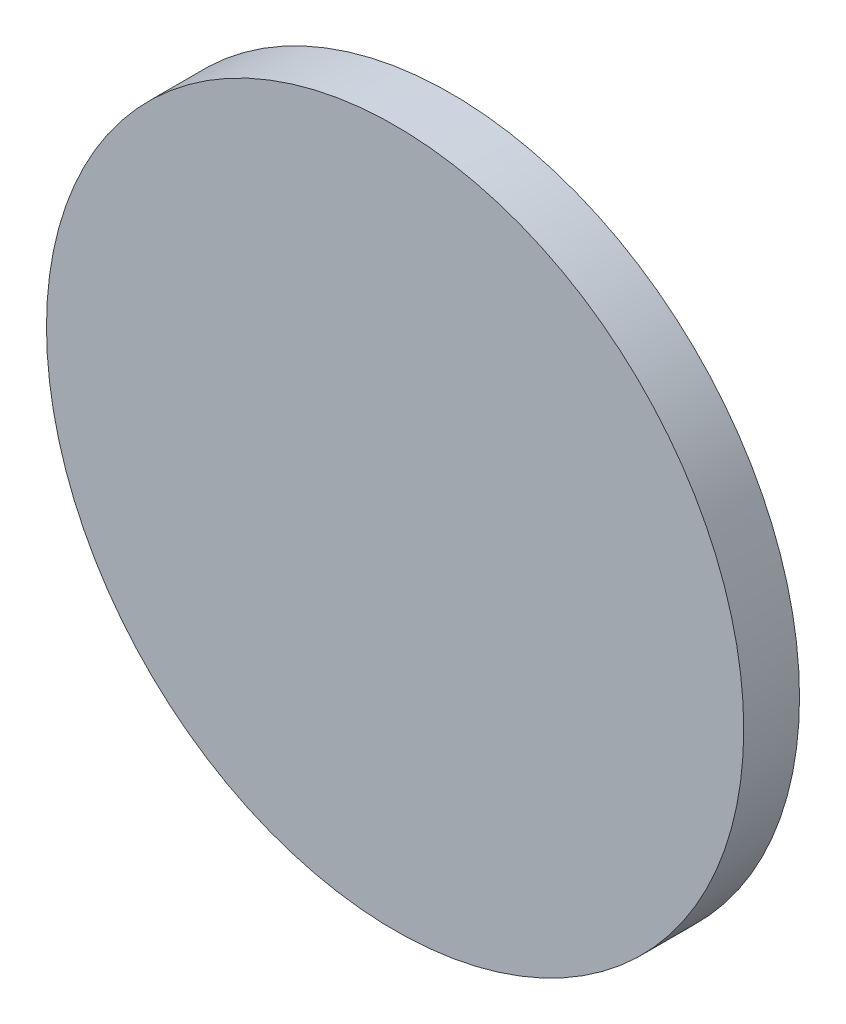
from build123d import *

# Parameters (mm, degrees)
SKETCH1_R           = 6.25
BOSS_EXTRUDE1_DEPTH = 1


with BuildPart() as part:
    # Sketch1 → Boss-Extrude1 (new body)
    with BuildSketch(Plane.XY):
        Circle(SKETCH1_R)
    extrude(amount=BOSS_EXTRUDE1_DEPTH)


solid = part.part
